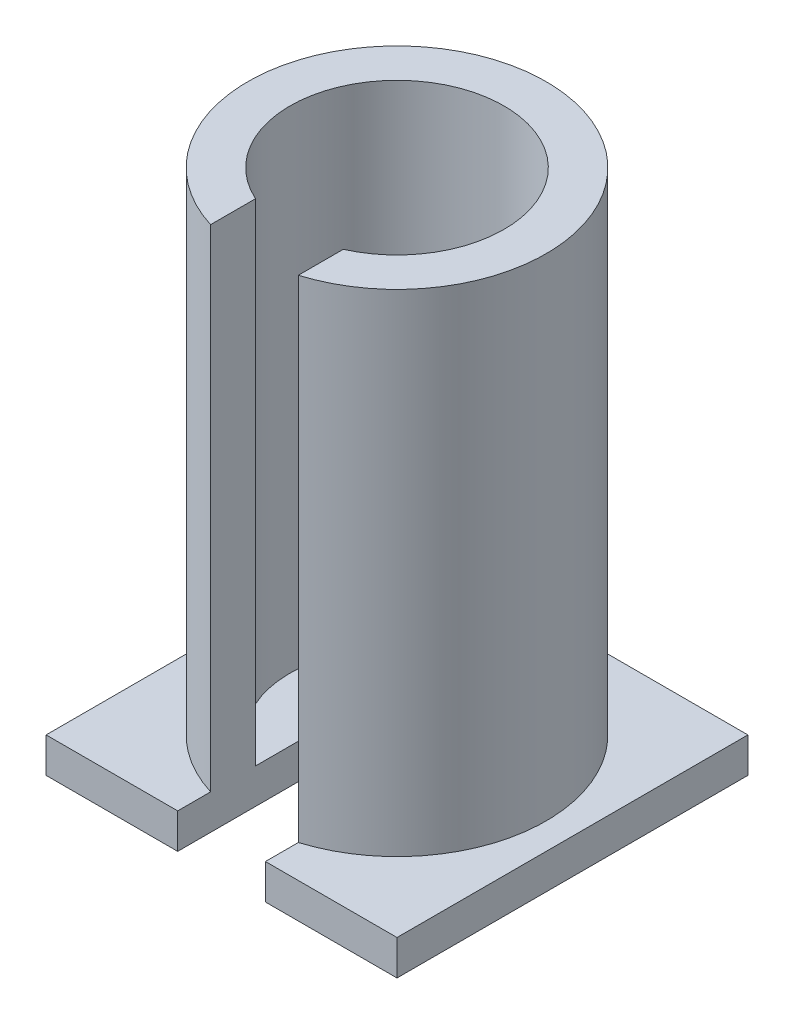
from build123d import *

# Parameters (mm, degrees)
SKETCH1_R           = 4.25
SKETCH1_R_2         = 3.05
BOSS_EXTRUDE1_DEPTH = 15
SKETCH2_R           = 3.05
SKETCH2_R_2         = 1.25
BOSS_EXTRUDE2_DEPTH = 1
CUT_EXTRUDE1_DEPTH  = 15
BOSS_EXTRUDE3_DEPTH = 1


with BuildPart() as part:
    # Sketch1 → Boss-Extrude1 (new body)
    with BuildSketch(Plane(origin=(0, 0, 0), x_dir=(1, 0, 0), z_dir=(0, 1, 0))):
        with Locations(Location((0, 0, 0), (0, 0, 270))):
            Circle(SKETCH1_R)
        with Locations(Location((0, 0, 0), (0, 0, 270))):
            Circle(SKETCH1_R_2, mode=Mode.SUBTRACT)
    extrude(amount=BOSS_EXTRUDE1_DEPTH)

    # Sketch2 → Boss-Extrude2 (add)
    with BuildSketch(Plane(origin=(0, 0, 0), x_dir=(1, 0, 0), z_dir=(0, 1, 0))):
        with Locations(Location((0, 0, 0), (0, 0, 270))):
            Circle(SKETCH2_R)
        with Locations(Location((0, 0, 0), (0, 0, 270))):
            Circle(SKETCH2_R_2, mode=Mode.SUBTRACT)
    extrude(amount=BOSS_EXTRUDE2_DEPTH)

    # Sketch3 → Cut-Extrude1 (cut)
    with BuildSketch(Plane(origin=(0, 0, 0), x_dir=(1, 0, 0), z_dir=(0, 1, 0))):
        with BuildLine():
            ThreePointArc((1.25, 0), (0, -1.25), (-1.25, 0))
            Line((-1.25, 0), (-1.25, -5.072282681))
            Line((-1.25, -5.072282681), (1.25, -5.072282681))
            Line((1.25, -5.072282681), (1.25, 0))
        make_face()
    extrude(amount=CUT_EXTRUDE1_DEPTH, mode=Mode.SUBTRACT)

    # Sketch4 → Boss-Extrude3 (add)
    with BuildSketch(Plane(origin=(0, 0, 0), x_dir=(1, 0, 0), z_dir=(0, 1, 0))):
        with BuildLine():
            Line((-1.25, -5), (-1.25, 0))
            ThreePointArc((-1.25, 0), (0, 1.25), (1.25, 0))
            Line((1.25, 0), (1.25, -5))
            Line((1.25, -5), (5, -5))
            Line((5, -5), (5, 5))
            Line((5, 5), (-5, 5))
            Line((-5, 5), (-5, -5))
            Line((-5, -5), (-1.25, -5))
        make_face()
    extrude(amount=BOSS_EXTRUDE3_DEPTH)


solid = part.part
